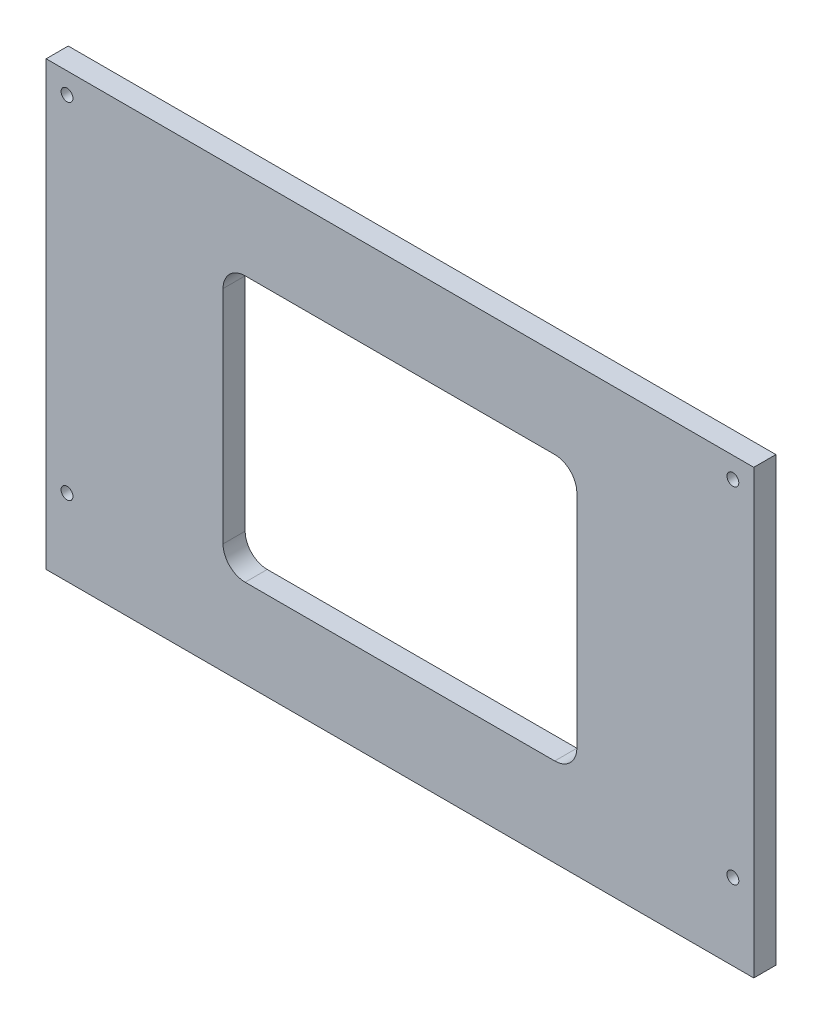
from build123d import *

# Parameters (mm, degrees)
SKETCH1_W            = 203.2
SKETCH1_H            = 127
BOSS_EXTRUDE1_DEPTH  = 6.35
M3_CLEARANCE_HOLE1_D = 3.4
SKETCH6_W            = 101.6
SKETCH6_H            = 76.2
CUT_EXTRUDE3_DEPTH   = 240.70724332
FILLET1_R            = 6.35


with BuildPart() as part:
    # Sketch1 → Boss-Extrude1 (new body)
    with BuildSketch(Plane.XY):
        with Locations((101.6, 63.5)):
            Rectangle(SKETCH1_W, SKETCH1_H)
    extrude(amount=BOSS_EXTRUDE1_DEPTH)

    # M3 Clearance Hole1 (through all)
    with Locations(Plane.XY.offset(6.35)):
        with Locations((5.9944, 121.0056), (5.9944, 21.9964), (197.2056, 21.9964), (197.2056, 121.0056)):
            Hole(M3_CLEARANCE_HOLE1_D / 2)

    # Sketch6 → Cut-Extrude3 (cut, through all)
    with BuildSketch(Plane.XY.offset(6.35)):
        with Locations((101.6, 63.5)):
            Rectangle(SKETCH6_W, SKETCH6_H)
    extrude(amount=-CUT_EXTRUDE3_DEPTH, mode=Mode.SUBTRACT)

    # Fillet1
    fillet1_edges = [part.edges().sort_by_distance(p)[0] for p in [
        (152.4, 101.6, 3.175),
        (152.4, 25.4, 3.175),
        (50.8, 25.4, 3.175),
        (50.8, 101.6, 3.175),
    ]]
    fillet(fillet1_edges, radius=FILLET1_R)


solid = part.part
